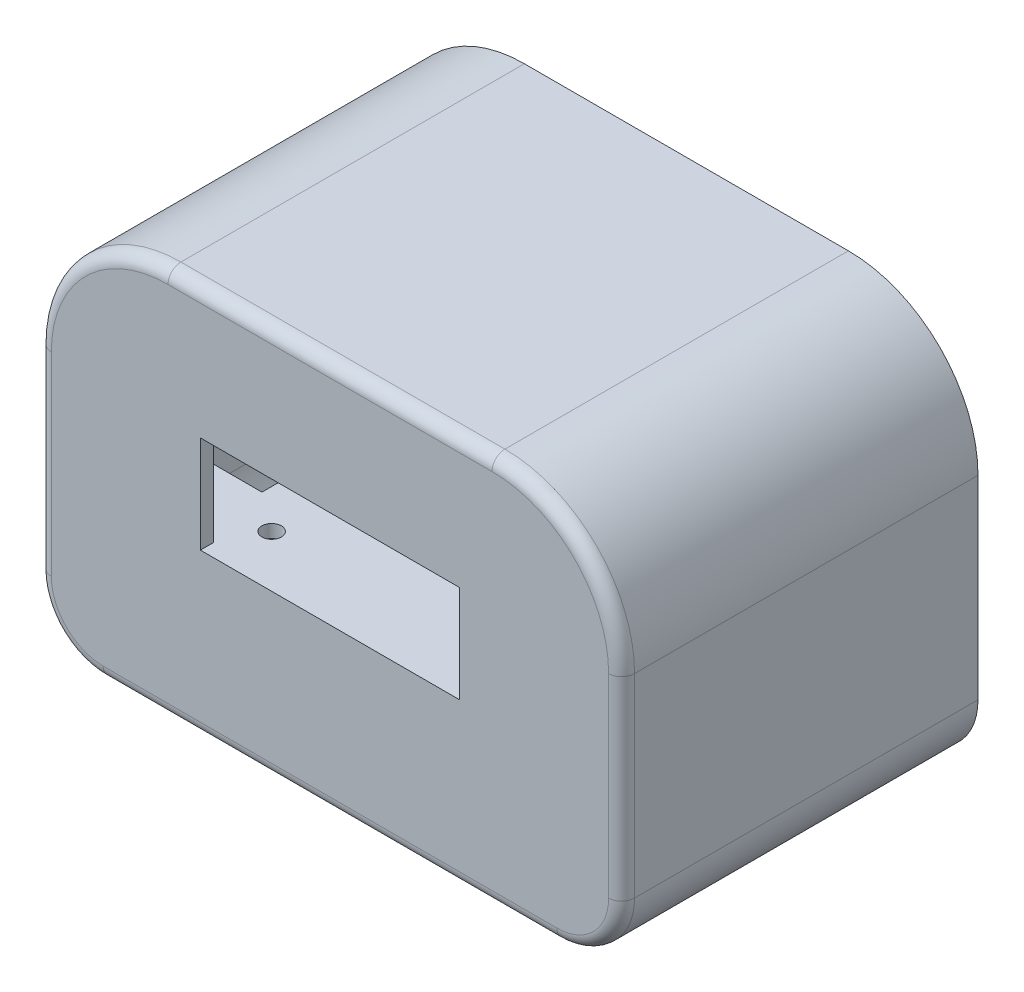
from build123d import *

# Parameters (mm, degrees)
BOSS_EXTRUDE1_DEPTH       = 55
SHELL1_T                  = -2
BOSS_EXTRUDE2_DEPTH       = 10
M3X0_5_TAPPED_HOLE1_D     = 2.5
M3X0_5_TAPPED_HOLE1_DEPTH = 7.5
M3X0_5_TAPPED_HOLE1_TIP   = 0.751075774
BOSS_EXTRUDE3_REACH       = 79.136
SKETCH5_W                 = 86
SKETCH5_H                 = 2
SKETCH6_W                 = 40
SKETCH6_H                 = 15
CUT_EXTRUDE1_DEPTH        = 10
F_3_0MM_DOWEL_HOLE1_D     = 3
F_3_0MM_DOWEL_HOLE1_DEPTH = 4
F_3_0MM_DOWEL_HOLE1_TIP   = 0.901290929
SKETCH9_W                 = 20
SKETCH9_H                 = 16
CUT_EXTRUDE2_DEPTH        = 2
FILLET1_R                 = 2


with BuildPart() as part:
    # Sketch1 → Boss-Extrude1 (new body)
    with BuildSketch(Plane.XY):
        with BuildLine():
            Line((-25, 30), (25, 30))
            ThreePointArc((25, 30), (39.142135624, 24.142135624), (45, 10))
            Line((45, 10), (45, -20))
            ThreePointArc((45, -20), (42.071067812, -27.071067812), (35, -30))
            Line((35, -30), (-35, -30))
            ThreePointArc((-35, -30), (-42.071067812, -27.071067812), (-45, -20))
            Line((-45, -20), (-45, 10))
            ThreePointArc((-45, 10), (-39.142135624, 24.142135624), (-25, 30))
        make_face()
    extrude(amount=BOSS_EXTRUDE1_DEPTH)

    # Shell1
    shell1_openings = [part.faces().sort_by_distance(p)[0] for p in [
        (0, -0.615524706, 0),
    ]]
    offset(amount=SHELL1_T, openings=shell1_openings, kind=Kind.INTERSECTION)

    # Sketch2 → Boss-Extrude2 (add)
    with BuildSketch(Plane(origin=(0, 0, 0), x_dir=(-1, 0, 0), z_dir=(0, 0, -1))):
        with BuildLine():
            Line((-23, 18.48), (-40.87732975, 18.48))
            ThreePointArc((-40.87732975, 18.48), (-34.256349172, 25.437616396), (-25, 28))
            Line((-25, 28), (-23, 28))
            Line((-23, 28), (-23, 18.48))
        make_face()
        with BuildLine():
            Line((23, 18.48), (40.87732975, 18.48))
            ThreePointArc((40.87732975, 18.48), (34.256349172, 25.437616396), (25, 28))
            Line((25, 28), (23, 28))
            Line((23, 28), (23, 18.48))
        make_face()
    extrude(amount=-BOSS_EXTRUDE2_DEPTH)

    # M3x0.5 Tapped Hole1
    with Locations(Plane(origin=(0, 0, 0), x_dir=(-1, 0, 0), z_dir=(0, 0, -1))):
        with Locations((-28.5, 22), (28.5, 22)):
            Hole(M3X0_5_TAPPED_HOLE1_D / 2, depth=M3X0_5_TAPPED_HOLE1_DEPTH)
            with Locations((0, 0, -(M3X0_5_TAPPED_HOLE1_DEPTH + M3X0_5_TAPPED_HOLE1_TIP / 2))):  # 118° drill point
                Cone(0, M3X0_5_TAPPED_HOLE1_D / 2, M3X0_5_TAPPED_HOLE1_TIP, mode=Mode.SUBTRACT)

    # Sketch5 → Boss-Extrude3 (add, up to next)
    with BuildSketch(Plane(origin=(0, 0, 0), x_dir=(-1, 0, 0), z_dir=(0, 0, -1)), mode=Mode.PRIVATE) as boss_extrude3_sk1:
        with Locations((0, -6)):
            Rectangle(SKETCH5_W, SKETCH5_H)
    boss_extrude3_tool1 = extrude(boss_extrude3_sk1.sketch, amount=-BOSS_EXTRUDE3_REACH, mode=Mode.PRIVATE) - part.part
    add(boss_extrude3_tool1.solids().sort_by_distance((0, -6, 0))[0])

    # Sketch6 → Cut-Extrude1 (cut)
    with BuildSketch(Plane(origin=(0, 0, 53), x_dir=(-1, 0, 0), z_dir=(0, 0, -1))):
        with Locations((0, 2.5)):
            Rectangle(SKETCH6_W, SKETCH6_H)
    extrude(amount=-CUT_EXTRUDE1_DEPTH, mode=Mode.SUBTRACT)

    # Ø3.0mm Dowel Hole1
    with Locations(Plane(origin=(0, -5, 0), x_dir=(1, 0, 0), z_dir=(0, 1, 0))):
        with Locations((-17, -47), (-17, -22), (17, -34.5)):
            Hole(F_3_0MM_DOWEL_HOLE1_D / 2, depth=F_3_0MM_DOWEL_HOLE1_DEPTH)
            with Locations((0, 0, -(F_3_0MM_DOWEL_HOLE1_DEPTH + F_3_0MM_DOWEL_HOLE1_TIP / 2))):  # 118° drill point
                Cone(0, F_3_0MM_DOWEL_HOLE1_D / 2, F_3_0MM_DOWEL_HOLE1_TIP, mode=Mode.SUBTRACT)

    # Sketch9 → Cut-Extrude2 (cut)
    with BuildSketch(Plane(origin=(0, -5, 0), x_dir=(1, 0, 0), z_dir=(0, 1, 0))):
        with Locations((-33, -34.5)):
            Rectangle(SKETCH9_W, SKETCH9_H)
    extrude(amount=-CUT_EXTRUDE2_DEPTH, mode=Mode.SUBTRACT)

    # Fillet1
    fillet1_edges = [part.edges().sort_by_distance(p)[0] for p in [
        (39.142135624, 24.142135624, 55),
        (0, 30, 55),
        (-39.142135624, 24.142135624, 55),
        (-45, -5, 55),
        (-42.071067812, -27.071067812, 55),
        (0, -30, 55),
        (42.071067812, -27.071067812, 55),
        (45, -5, 55),
    ]]
    fillet(fillet1_edges, radius=FILLET1_R)


solid = part.part
